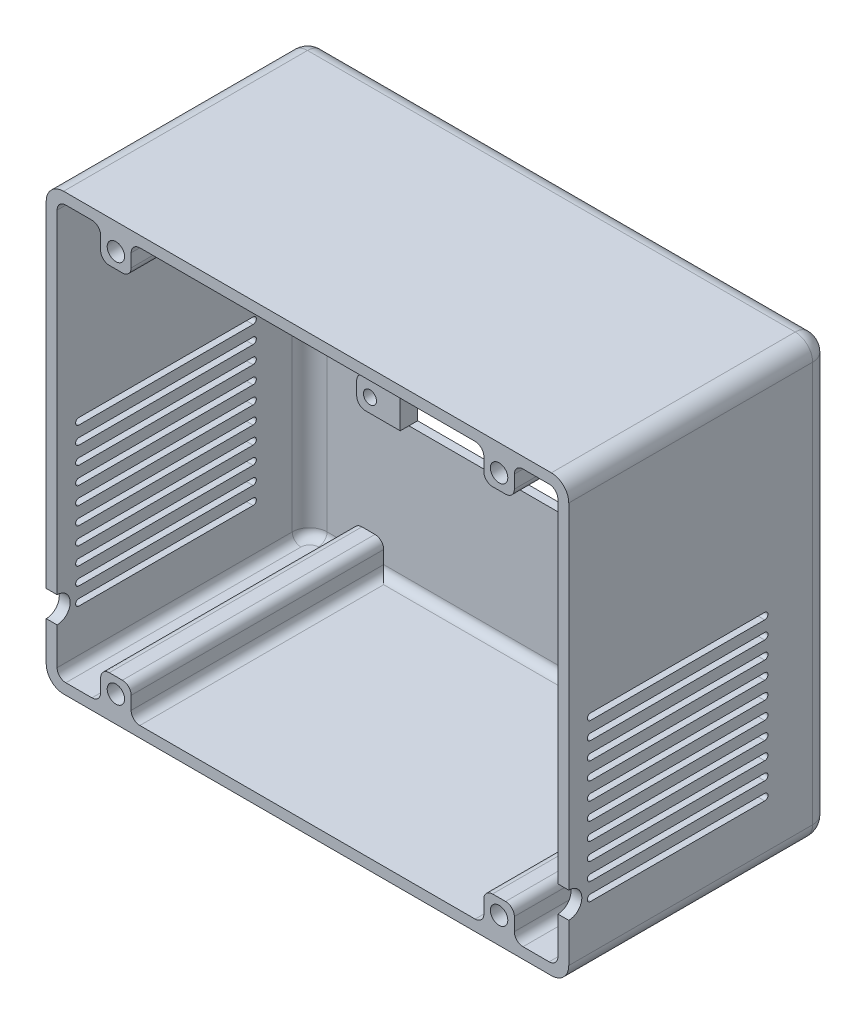
from build123d import *

# Parameters (mm, degrees)
SZKIC1_W                        = 10
SZKIC1_H                        = 50
SZKIC1_R                        = 1.5
DODANIE_WYCI_GNI_CIE2_DEPTH     = 4
DODANIE_WYCI_GNI_CIE2_2_DEPTH   = 4
DODANIE_WYCI_GNI_CIE4_DEPTH     = 2
SZKIC1_9_W                      = 120
SZKIC1_9_H                      = 100
SZKIC1_9_W_2                    = 115
SZKIC1_9_H_2                    = 95
SZKIC1_9_W_3                    = 7
SZKIC1_9_H_3                    = 7
DODANIE_WYCI_GNI_CIE5_DEPTH     = 60
SZKIC1_10_R                     = 1.5
DODANIE_WYCI_GNI_CIE6_DEPTH     = 1
SZKIC5_W                        = 10
SZKIC5_H                        = 36
WYTNIJ_WYCI_GNI_CIE1_DEPTH      = 2
SZKIC9_R                        = 2
WYTNIJ_WYCI_GNI_CIE2_DEPTH      = 32
WYTNIJ_WYCI_GNI_CIE3_DEPTH      = 148.643139278
WYTNIJ_WYCI_GNI_CIE3_DEPTH_BACK = 148.643139278
SZKIC13_R                       = 3
WYTNIJ_WYCI_GNI_CIE4_DEPTH      = 148.643139278
ZAOKR_GLENIE2_R                 = 4
ZAOKR_GLENIE3_R                 = 2


with BuildPart() as part:
    # Szkic1 → Dodanie-wyciągnięcie2 (new body)
    with BuildSketch(Plane.XY):
        with Locations((25.32383216, -1.631944444)):
            Rectangle(SZKIC1_W, SZKIC1_H)
        with Locations((23.52383216, 20.168055556)):
            Circle(SZKIC1_R, mode=Mode.SUBTRACT)
        with Locations((23.366003622, -23.431944444)):
            Circle(SZKIC1_R, mode=Mode.SUBTRACT)
    extrude(amount=DODANIE_WYCI_GNI_CIE2_DEPTH)



with BuildPart() as body_2:
    # Szkic1 → Dodanie-wyci_gni_cie2 2 (new body)
    with BuildSketch(Plane.XY):
        with Locations((104.72383216, -1.631944444)):
            Rectangle(SZKIC1_W, SZKIC1_H)
        with Locations((106.366003622, 20.168055556)):
            Circle(SZKIC1_R, mode=Mode.SUBTRACT)
        with Locations((106.52383216, -23.431944444)):
            Circle(SZKIC1_R, mode=Mode.SUBTRACT)
    extrude(amount=DODANIE_WYCI_GNI_CIE2_2_DEPTH)


with BuildPart() as part_1:
    add(part.part)

    add(body_2.part)  # Dodanie-wyciągnięcie4 merges body 2
    # Szkic1<8> → Dodanie-wyciągnięcie4 (add)
    with BuildSketch(Plane.XY):
        Polygon((17.52383216, 35.868055556), (7.52383216, 35.868055556), (7.52383216, -59.131944444), (17.52383216, -59.131944444), (17.52383216, -52.131944444), (24.52383216, -52.131944444), (24.52383216, -59.131944444), (105.52383216, -59.131944444), (105.52383216, -52.131944444), (112.52383216, -52.131944444), (112.52383216, -59.131944444), (122.52383216, -59.131944444), (122.52383216, 35.868055556), (112.52383216, 35.868055556), (112.52383216, 28.868055556), (105.52383216, 28.868055556), (105.52383216, 35.868055556), (24.52383216, 35.868055556), (24.52383216, 28.868055556), (17.52383216, 28.868055556), align=None)
        Polygon((20.32383216, 23.368055556), (30.32383216, 23.368055556), (99.72383216, 23.368055556), (109.72383216, 23.368055556), (109.72383216, 8.368055556), (109.72383216, -11.631944444), (109.72383216, -26.631944444), (99.72383216, -26.631944444), (30.32383216, -26.631944444), (20.32383216, -26.631944444), (20.32383216, -11.631944444), (20.32383216, 8.368055556), align=None, mode=Mode.SUBTRACT)
    extrude(amount=DODANIE_WYCI_GNI_CIE4_DEPTH)

    # Szkic1<9> → Dodanie-wyciągnięcie5 (add)
    # profile 1 of 5: a face of its own
    with BuildSketch(Plane.XY):
        with Locations((65.02383216, -11.631944444)):
            Rectangle(SZKIC1_9_W, SZKIC1_9_H)
        with Locations((65.02383216, -11.631944444)):
            Rectangle(SZKIC1_9_W_2, SZKIC1_9_H_2, mode=Mode.SUBTRACT)
    # profile 2 of 5: a face of its own
    with BuildSketch(Plane.XY):
        with Locations((21.02383216, 32.368055556)):
            Rectangle(SZKIC1_9_W_3, SZKIC1_9_H_3)
    # profile 3 of 5: a face of its own
    with BuildSketch(Plane.XY):
        with Locations((109.02383216, 32.368055556)):
            Rectangle(SZKIC1_9_W_3, SZKIC1_9_H_3)
    # profile 4 of 5: a face of its own
    with BuildSketch(Plane.XY):
        with Locations((109.02383216, -55.631944444)):
            Rectangle(SZKIC1_9_W_3, SZKIC1_9_H_3)
    # profile 5 of 5: a face of its own
    with BuildSketch(Plane.XY):
        with Locations((21.02383216, -55.631944444)):
            Rectangle(SZKIC1_9_W_3, SZKIC1_9_H_3)
    extrude(amount=DODANIE_WYCI_GNI_CIE5_DEPTH)

    # Szkic1<10> → Dodanie-wyciągnięcie6 (add)
    with BuildSketch(Plane.XY):
        with Locations((23.52383216, 20.168055556)):
            Circle(SZKIC1_10_R)
        with Locations((23.366003622, -23.431944444)):
            Circle(SZKIC1_10_R)
        with Locations((106.52383216, -23.431944444)):
            Circle(SZKIC1_10_R)
        with Locations((106.366003622, 20.168055556)):
            Circle(SZKIC1_10_R)
    extrude(amount=DODANIE_WYCI_GNI_CIE6_DEPTH)

    # Szkic5 → Wytnij-wyciągnięcie1 (cut)
    with BuildSketch(Plane.XY.offset(4)):
        with Locations((25.32383216, -1.631944444)):
            Rectangle(SZKIC5_W, SZKIC5_H)
        with Locations((104.72383216, -1.631944444)):
            Rectangle(SZKIC5_W, SZKIC5_H)
    extrude(amount=-WYTNIJ_WYCI_GNI_CIE1_DEPTH, mode=Mode.SUBTRACT)

    # Szkic9 → Wytnij-wyciągnięcie2 (cut)
    with BuildSketch(Plane.XY.offset(60)):
        with Locations((21.02383216, 32.368055556)):
            Circle(SZKIC9_R)
        with Locations((109.02383216, 32.368055556)):
            Circle(SZKIC9_R)
        with Locations((21.02383216, -55.631944444)):
            Circle(SZKIC9_R)
        with Locations((109.02383216, -55.631944444)):
            Circle(SZKIC9_R)
    extrude(amount=-WYTNIJ_WYCI_GNI_CIE2_DEPTH, mode=Mode.SUBTRACT)

    # Szkic11 → Wytnij-wyciągnięcie3 (cut, two sides: drawn at the far end of the back side and taken through both)
    with BuildSketch(Plane.ZY.offset(-5.02383216).offset(-WYTNIJ_WYCI_GNI_CIE3_DEPTH_BACK)):
        with BuildLine():
            Line((15, -45.881944444), (55, -45.881944444))
            ThreePointArc((55, -45.881944444), (55.75, -46.631944444), (55, -47.381944444))
            Line((55, -47.381944444), (15, -47.381944444))
            ThreePointArc((15, -47.381944444), (14.25, -46.631944444), (15, -45.881944444))
        make_face()
        with BuildLine():
            Line((15, -41.881944444), (55, -41.881944444))
            ThreePointArc((55, -41.881944444), (55.75, -42.631944444), (55, -43.381944444))
            Line((55, -43.381944444), (15, -43.381944444))
            ThreePointArc((15, -43.381944444), (14.25, -42.631944444), (15, -41.881944444))
        make_face()
        with BuildLine():
            Line((15, -37.881944444), (55, -37.881944444))
            ThreePointArc((55, -37.881944444), (55.75, -38.631944444), (55, -39.381944444))
            Line((55, -39.381944444), (15, -39.381944444))
            ThreePointArc((15, -39.381944444), (14.25, -38.631944444), (15, -37.881944444))
        make_face()
        with BuildLine():
            Line((15, -33.881944444), (55, -33.881944444))
            ThreePointArc((55, -33.881944444), (55.75, -34.631944444), (55, -35.381944444))
            Line((55, -35.381944444), (15, -35.381944444))
            ThreePointArc((15, -35.381944444), (14.25, -34.631944444), (15, -33.881944444))
        make_face()
        with BuildLine():
            Line((15, -29.881944444), (55, -29.881944444))
            ThreePointArc((55, -29.881944444), (55.75, -30.631944444), (55, -31.381944444))
            Line((55, -31.381944444), (15, -31.381944444))
            ThreePointArc((15, -31.381944444), (14.25, -30.631944444), (15, -29.881944444))
        make_face()
        with BuildLine():
            Line((15, -25.881944444), (55, -25.881944444))
            ThreePointArc((55, -25.881944444), (55.75, -26.631944444), (55, -27.381944444))
            Line((55, -27.381944444), (15, -27.381944444))
            ThreePointArc((15, -27.381944444), (14.25, -26.631944444), (15, -25.881944444))
        make_face()
        with BuildLine():
            Line((15, -21.881944444), (55, -21.881944444))
            ThreePointArc((55, -21.881944444), (55.75, -22.631944444), (55, -23.381944444))
            Line((55, -23.381944444), (15, -23.381944444))
            ThreePointArc((15, -23.381944444), (14.25, -22.631944444), (15, -21.881944444))
        make_face()
        with BuildLine():
            Line((15, -17.881944444), (55, -17.881944444))
            ThreePointArc((55, -17.881944444), (55.75, -18.631944444), (55, -19.381944444))
            Line((55, -19.381944444), (15, -19.381944444))
            ThreePointArc((15, -19.381944444), (14.25, -18.631944444), (15, -17.881944444))
        make_face()
        with BuildLine():
            Line((15, -13.881944444), (55, -13.881944444))
            ThreePointArc((55, -13.881944444), (55.75, -14.631944444), (55, -15.381944444))
            Line((55, -15.381944444), (15, -15.381944444))
            ThreePointArc((15, -15.381944444), (14.25, -14.631944444), (15, -13.881944444))
        make_face()
        with BuildLine():
            Line((15, -9.881944444), (55, -9.881944444))
            ThreePointArc((55, -9.881944444), (55.75, -10.631944444), (55, -11.381944444))
            Line((55, -11.381944444), (15, -11.381944444))
            ThreePointArc((15, -11.381944444), (14.25, -10.631944444), (15, -9.881944444))
        make_face()
    extrude(amount=WYTNIJ_WYCI_GNI_CIE3_DEPTH + WYTNIJ_WYCI_GNI_CIE3_DEPTH_BACK, mode=Mode.SUBTRACT)

    # Szkic13 → Wytnij-wyciągnięcie4 (cut, through all)
    with BuildSketch(Plane.ZY.offset(-5.02383216)):
        with Locations((60, -45.631944444)):
            Circle(SZKIC13_R)
    extrude(amount=-WYTNIJ_WYCI_GNI_CIE4_DEPTH, mode=Mode.SUBTRACT)

    # Zaokrąglenie2
    zaokr_glenie2_edges = [part_1.edges().sort_by_distance(p)[0] for p in [
        (125.02383216, 38.368055556, 30),
        (5.02383216, -11.631944444, 0),
        (5.02383216, 38.368055556, 30),
        (65.02383216, -61.631944444, 0),
        (5.02383216, -61.631944444, 30),
        (125.02383216, -61.631944444, 30),
        (125.02383216, -11.631944444, 0),
        (65.02383216, 38.368055556, 0),
        (7.52383216, -11.631944444, 2),
    ]]
    fillet(zaokr_glenie2_edges, radius=ZAOKR_GLENIE2_R)

    # Zaokrąglenie3
    zaokr_glenie3_edges = [part_1.edges().sort_by_distance(p)[0] for p in [
        (24.52383216, 35.868055556, 31),
        (112.52383216, 35.868055556, 31),
        (122.52383216, 35.868055556, 31),
        (122.52383216, -59.131944444, 31),
        (112.52383216, -59.131944444, 31),
        (105.52383216, -59.131944444, 31),
        (24.52383216, -59.131944444, 31),
        (17.52383216, -59.131944444, 31),
        (7.52383216, -59.131944444, 33),
        (7.52383216, 35.868055556, 33),
        (17.52383216, -52.131944444, 31),
        (24.52383216, -52.131944444, 31),
        (105.52383216, -52.131944444, 31),
        (112.52383216, -52.131944444, 31),
        (112.52383216, 28.868055556, 31),
        (105.52383216, 35.868055556, 31),
        (105.52383216, 28.868055556, 31),
        (24.52383216, 28.868055556, 31),
        (17.52383216, 35.868055556, 31),
        (17.52383216, 28.868055556, 31),
        (20.32383216, -26.631944444, 3),
        (20.32383216, 23.368055556, 3),
        (20.32383216, -19.631944444, 3),
        (20.32383216, 16.368055556, 3),
        (109.72383216, 16.368055556, 3),
        (109.72383216, -19.631944444, 3),
        (122.52383216, -11.631944444, 2),
        (117.52383216, 35.868055556, 2),
        (65.02383216, 35.868055556, 2),
        (65.02383216, -59.131944444, 2),
        (117.52383216, -59.131944444, 2),
        (14.52383216, 35.868055556, 2),
        (14.52383216, -59.131944444, 2),
        (8.695405035, -59.131944444, 3.171572875),
        (8.695405035, 35.868055556, 3.171572875),
        (109.72383216, -26.631944444, 3),
        (109.72383216, 23.368055556, 3),
    ]]
    fillet(zaokr_glenie3_edges, radius=ZAOKR_GLENIE3_R)


solid = part_1.part
